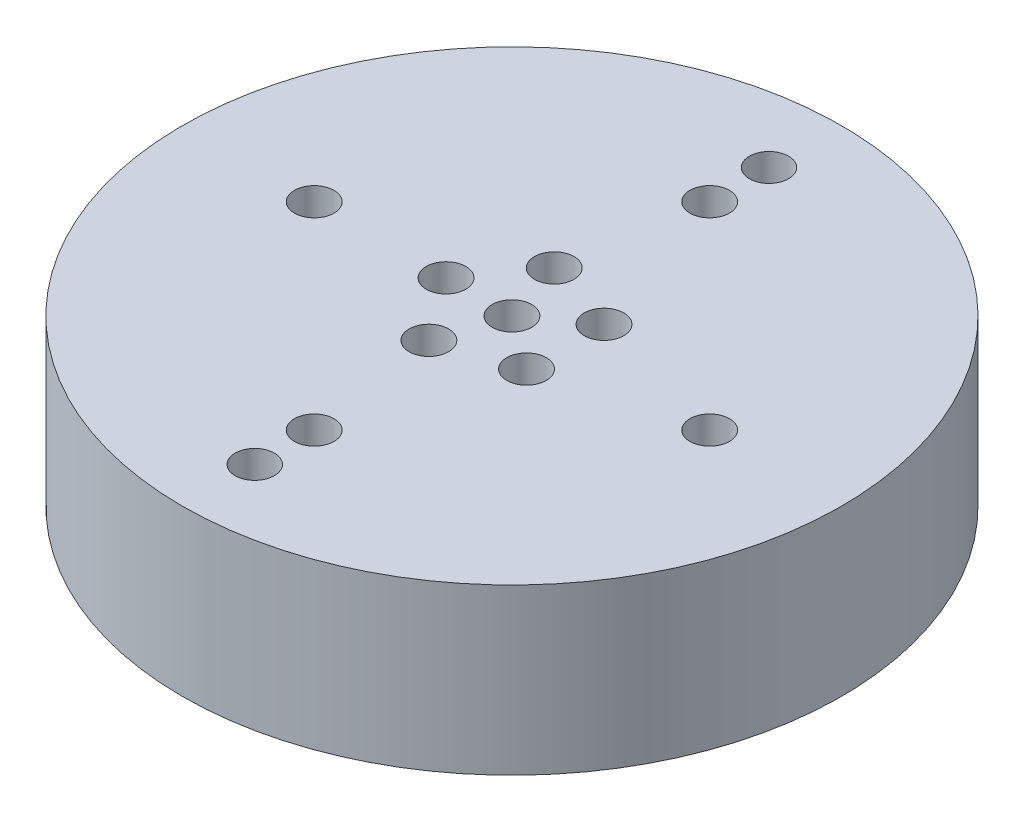
from build123d import *

# Parameters (mm, degrees)
SKETCH1_R           = 12.7
BOSS_EXTRUDE1_DEPTH = 6.35
SKETCH2_R           = 9.271
CUT_EXTRUDE1_DEPTH  = 3.175
CIRPATTERN1_COUNT   = 2
SKETCH6_R           = 0.762
CUT_EXTRUDE2_DEPTH  = 3.175


with BuildPart() as part:
    # Sketch1 → Boss-Extrude1 (new body)
    with BuildSketch(Plane(origin=(0, 0, 0), x_dir=(1, 0, 0), z_dir=(0, 1, 0))):
        with Locations(Location((0, 0, 0), (0, 0, 270))):
            Circle(SKETCH1_R)
    extrude(amount=BOSS_EXTRUDE1_DEPTH)

    # Sketch2 → Cut-Extrude1 (cut)
    with BuildSketch(Plane.XZ):
        with Locations(Location((0, 0, 0), (0, 0, 270))):
            Circle(SKETCH2_R)
    extrude(amount=-CUT_EXTRUDE1_DEPTH, mode=Mode.SUBTRACT)

    # Sketch5 → #1-72 Tapped Hole1 (revolve, cut)
    with BuildSketch(Plane(origin=(0, 0, -9.906), x_dir=(0, 0, -1), z_dir=(1, 0, 0))):
        Polygon((0, 0), (0, 11.630040327), (0.75565, 11.176), (0.75565, 0), align=None)
    f_1_72_tapped_hole1 = revolve(axis=Axis((0, -6.35, -9.906), (0, 1, 0)), mode=Mode.SUBTRACT)

    # CirPattern1: #1-72 Tapped Hole1 ×2 about axis
    cirpattern1_axis = Axis((0, 0, 0.002208913), (0, 1, 0))
    for i in range(1, CIRPATTERN1_COUNT):
        add(f_1_72_tapped_hole1.rotate(cirpattern1_axis, i * 360 / CIRPATTERN1_COUNT), mode=Mode.SUBTRACT)

    # Sketch6 → Cut-Extrude2 (cut)
    with BuildSketch(Plane(origin=(0, 6.35, 0), x_dir=(1, 0, 0), z_dir=(0, 1, 0))):
        with Locations(Location((0, 0, 0), (0, 0, 270))):
            Circle(SKETCH6_R)
        with Locations(Location((-2.54, 0, 0), (0, 0, 270))):
            Circle(SKETCH6_R)
        with Locations(Location((-0.784903166, 2.415683551, 0), (0, 0, 270))):
            Circle(SKETCH6_R)
        with Locations(Location((2.054903166, 1.492974541, 0), (0, 0, 270))):
            Circle(SKETCH6_R)
        with Locations(Location((2.054903166, -1.492974541, 0), (0, 0, 270))):
            Circle(SKETCH6_R)
        with Locations(Location((-0.784903166, -2.415683551, 0), (0, 0, 270))):
            Circle(SKETCH6_R)
        with Locations(Location((0, 7.62, 0), (0, 0, 270))):
            Circle(SKETCH6_R)
        with Locations(Location((7.62, 0, 0), (0, 0, 270))):
            Circle(SKETCH6_R)
        with Locations(Location((0, -7.62, 0), (0, 0, 270))):
            Circle(SKETCH6_R)
        with Locations(Location((-7.62, 0, 0), (0, 0, 270))):
            Circle(SKETCH6_R)
    extrude(amount=-CUT_EXTRUDE2_DEPTH, mode=Mode.SUBTRACT)


solid = part.part
